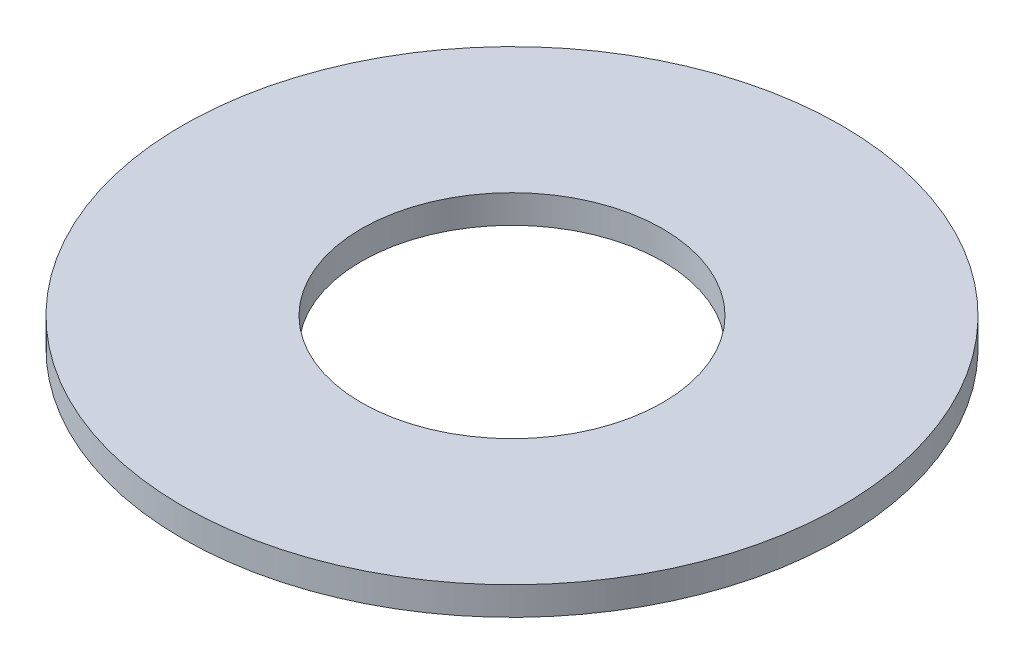
from build123d import *

# Parameters (mm, degrees)
SKETCH1_R           = 3.5
BOSS_EXTRUDE1_DEPTH = 0.3
SKETCH2_R           = 1.6
CUT_EXTRUDE1_DEPTH  = 5.958830507


with BuildPart() as part:
    # Sketch1 → Boss-Extrude1 (new body)
    with BuildSketch(Plane(origin=(0, 0, 0), x_dir=(1, 0, 0), z_dir=(0, 1, 0))):
        with Locations(Location((0, 0, 0), (0, 0, 270))):
            Circle(SKETCH1_R)
    extrude(amount=BOSS_EXTRUDE1_DEPTH)

    # Sketch2 → Cut-Extrude1 (cut, through all)
    with BuildSketch(Plane(origin=(0, 0.3, 0), x_dir=(-1, 0, 0), z_dir=(0, 1, 0))):
        with Locations(Location((0, 0, 0), (0, 0, 90))):
            Circle(SKETCH2_R)
    extrude(amount=-CUT_EXTRUDE1_DEPTH, mode=Mode.SUBTRACT)


solid = part.part
